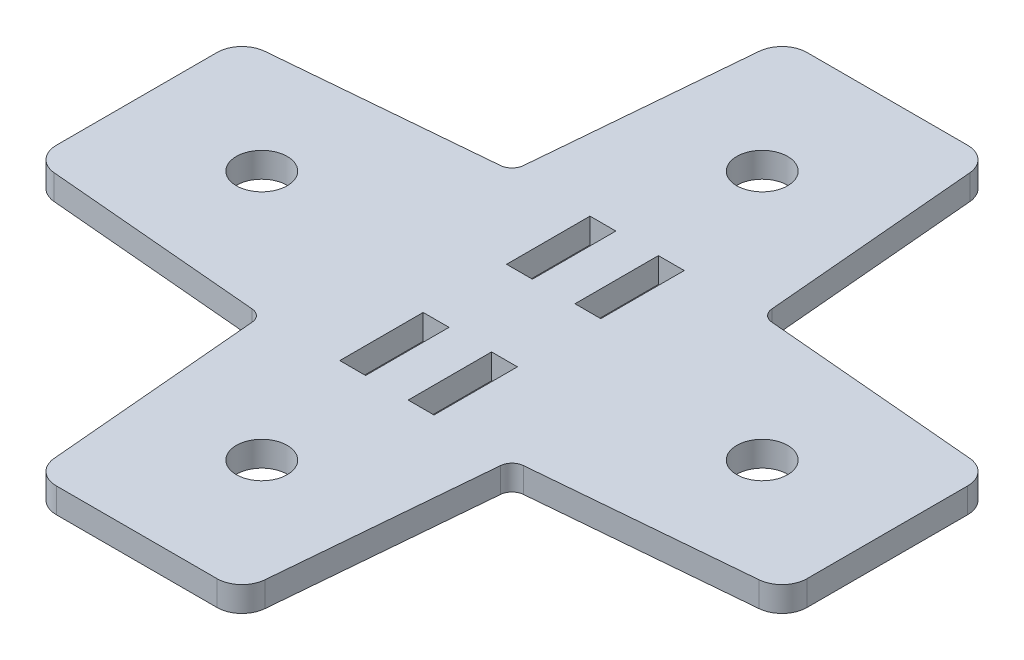
from build123d import *

# Parameters (mm, degrees)
SKETCH1_W                      = 3.1
SKETCH1_H                      = 10
BOSS_EXTRUDE1_DEPTH            = 3
F_6_1_6_1_DIAMETER_HOLE1_D     = 6.1
F_6_1_6_1_DIAMETER_HOLE1_DEPTH = 10
F_6_1_6_1_DIAMETER_HOLE1_TIP   = 1.832624888


with BuildPart() as part:
    # Sketch1 → Boss-Extrude1 (new body)
    with BuildSketch(Plane(origin=(0, 0, 0), x_dir=(1, 0, 0), z_dir=(0, 1, 0))):
        with BuildLine():
            Line((-14.890188717, 16.254064822), (-12.620010218, 42.260882944))
            ThreePointArc((-12.620010218, 42.260882944), (-11.658361887, 44.211633879), (-9.631375063, 45))
            Line((-9.631375063, 45), (9.631375063, 45))
            ThreePointArc((9.631375063, 45), (11.658361887, 44.211633879), (12.620010218, 42.260882944))
            Line((12.620010218, 42.260882944), (14.890188717, 16.254064822))
            ThreePointArc((14.890188717, 16.254064822), (15.323846122, 15.323846122), (16.254064822, 14.890188717))
            Line((16.254064822, 14.890188717), (42.260882944, 12.620010218))
            ThreePointArc((42.260882944, 12.620010218), (44.211633879, 11.658361887), (45, 9.631375063))
            Line((45, 9.631375063), (45, -9.631375063))
            ThreePointArc((45, -9.631375063), (44.211633879, -11.658361887), (42.260882944, -12.620010218))
            Line((42.260882944, -12.620010218), (16.254064822, -14.890188717))
            ThreePointArc((16.254064822, -14.890188717), (15.323846122, -15.323846122), (14.890188717, -16.254064822))
            Line((14.890188717, -16.254064822), (12.620010218, -42.260882944))
            ThreePointArc((12.620010218, -42.260882944), (11.658361887, -44.211633879), (9.631375063, -45))
            Line((9.631375063, -45), (-9.631375063, -45))
            ThreePointArc((-9.631375063, -45), (-11.658361887, -44.211633879), (-12.620010218, -42.260882944))
            Line((-12.620010218, -42.260882944), (-14.890188717, -16.254064822))
            ThreePointArc((-14.890188717, -16.254064822), (-15.323846122, -15.323846122), (-16.254064822, -14.890188717))
            Line((-16.254064822, -14.890188717), (-42.260882944, -12.620010218))
            ThreePointArc((-42.260882944, -12.620010218), (-44.211633879, -11.658361887), (-45, -9.631375063))
            Line((-45, -9.631375063), (-45, 9.631375063))
            ThreePointArc((-45, 9.631375063), (-44.211633879, 11.658361887), (-42.260882944, 12.620010218))
            Line((-42.260882944, 12.620010218), (-16.254064822, 14.890188717))
            ThreePointArc((-16.254064822, 14.890188717), (-15.323846122, 15.323846122), (-14.890188717, 16.254064822))
        make_face()
        with Locations((-4.1, 10)):
            Rectangle(SKETCH1_W, SKETCH1_H, mode=Mode.SUBTRACT)
        with Locations((4.1, 10)):
            Rectangle(SKETCH1_W, SKETCH1_H, mode=Mode.SUBTRACT)
        with Locations((4.1, -10)):
            Rectangle(SKETCH1_W, SKETCH1_H, mode=Mode.SUBTRACT)
        with Locations((-4.1, -10)):
            Rectangle(SKETCH1_W, SKETCH1_H, mode=Mode.SUBTRACT)
    extrude(amount=BOSS_EXTRUDE1_DEPTH)

    # Ø6.1 (6.1) Diameter Hole1
    with Locations(Plane(origin=(0, 3, 0), x_dir=(1, 0, 0), z_dir=(0, 1, 0))):
        with Locations((0, -30), (30, 0), (0, 30), (-30, 0)):
            Hole(F_6_1_6_1_DIAMETER_HOLE1_D / 2, depth=F_6_1_6_1_DIAMETER_HOLE1_DEPTH)
            with Locations((0, 0, -(F_6_1_6_1_DIAMETER_HOLE1_DEPTH + F_6_1_6_1_DIAMETER_HOLE1_TIP / 2))):  # 118° drill point
                Cone(0, F_6_1_6_1_DIAMETER_HOLE1_D / 2, F_6_1_6_1_DIAMETER_HOLE1_TIP, mode=Mode.SUBTRACT)


solid = part.part
